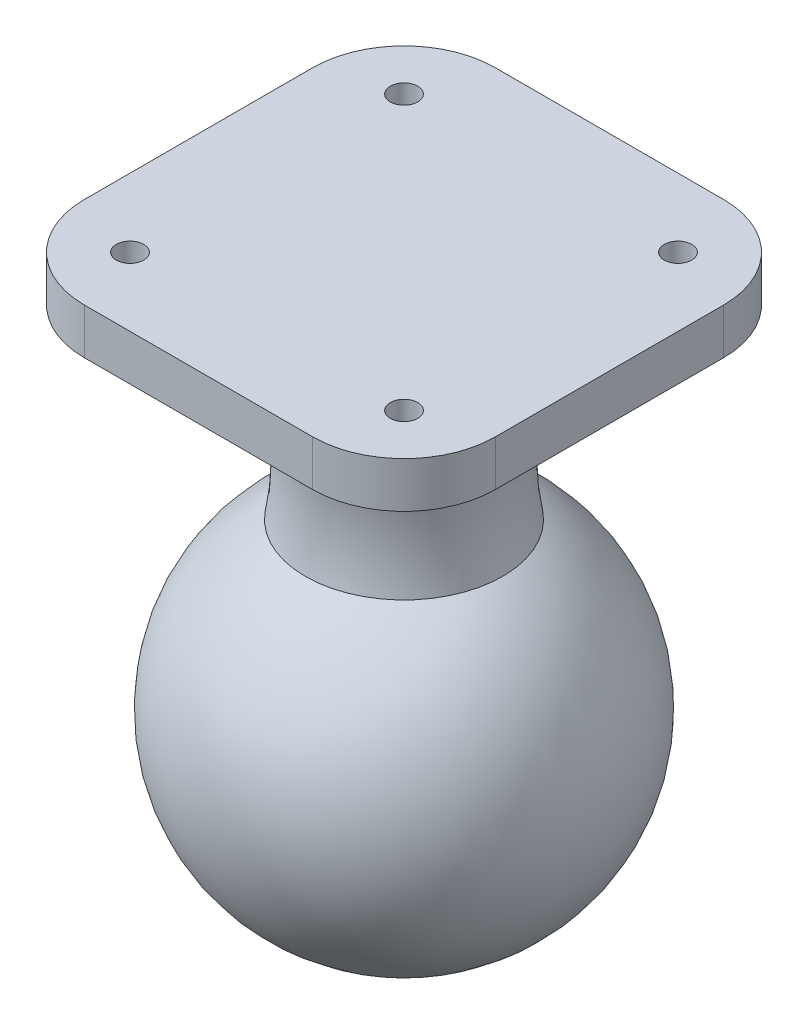
from build123d import *

# Parameters (mm, degrees)
SKETCH1_R           = 1.5
BOSS_EXTRUDE1_DEPTH = 5


with BuildPart() as part:
    # Sketch1 → Boss-Extrude1 (new body)
    with BuildSketch(Plane(origin=(0, 0, 0), x_dir=(1, 0, 0), z_dir=(0, 1, 0))):
        with BuildLine():
            Line((12.5, -22.5), (-12.5, -22.5))
            ThreePointArc((-12.5, -22.5), (-19.571067812, -19.571067812), (-22.5, -12.5))
            Line((-22.5, -12.5), (-22.5, 12.5))
            ThreePointArc((-22.5, 12.5), (-19.571067812, 19.571067812), (-12.5, 22.5))
            Line((-12.5, 22.5), (12.5, 22.5))
            ThreePointArc((12.5, 22.5), (19.571067812, 19.571067812), (22.5, 12.5))
            Line((22.5, 12.5), (22.5, -12.5))
            ThreePointArc((22.5, -12.5), (19.571067812, -19.571067812), (12.5, -22.5))
        make_face()
        with Locations(Location((-15, 15, 0), (0, 0, 270))):
            Circle(SKETCH1_R, mode=Mode.SUBTRACT)
        with Locations(Location((15, 15, 0), (0, 0, 90))):
            Circle(SKETCH1_R, mode=Mode.SUBTRACT)
        with Locations(Location((15, -15, 0), (0, 0, 270))):
            Circle(SKETCH1_R, mode=Mode.SUBTRACT)
        with Locations(Location((-15, -15, 0), (0, 0, 90))):
            Circle(SKETCH1_R, mode=Mode.SUBTRACT)
    extrude(amount=BOSS_EXTRUDE1_DEPTH)

    # Sketch5 → Revolve5 (revolve)
    with BuildSketch(Plane.XY, mode=Mode.PRIVATE) as revolve5_sk:
        with BuildLine():
            Line((0, 0), (0, -30))
            Line((0, -30), (-14.490872109, -30))
            ThreePointArc((-14.490872109, -30), (-10.310219401, -15), (-14.490872109, 0))
            Line((-14.490872109, 0), (0, 0))
        make_face()
    revolve(revolve5_sk.sketch.rotate(Axis((0, 6.623218914, 0), (0, -1, 0)), 270), axis=Axis((0, 6.623218914, 0), (0, -1, 0)))

    # Sketch6 → Revolve6 (revolve)
    with BuildSketch(Plane(origin=(0, 0, 0), x_dir=(0, 0, -1), z_dir=(1, 0, 0))):
        with BuildLine():
            Line((0, -17.323751058), (0, -59.119175033))
            ThreePointArc((0, -59.119175033), (-20.897711988, -38.221463045), (0, -17.323751058))
        make_face()
    revolve(axis=Axis((0, -62.962580504, 0), (0, 1, 0)))


solid = part.part
